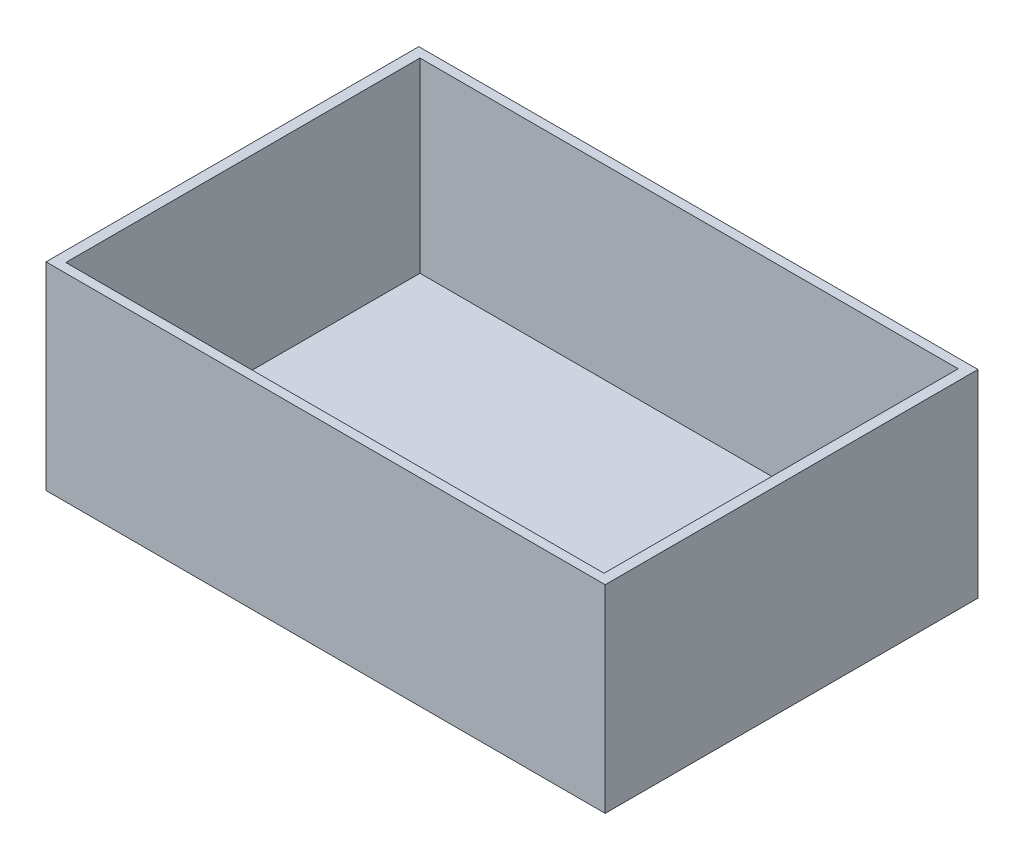
from build123d import *

# Parameters (mm, degrees)
ESQUISSE1_W             = 48
ESQUISSE1_H             = 32
BOSS_EXTRU_1_DEPTH      = 17
ESQUISSE3_W             = 46.2
ESQUISSE3_H             = 30.4
ENL_V_MAT_EXTRU_1_DEPTH = 16


with BuildPart() as part:
    # Esquisse1 → Boss.-Extru.1 (new body)
    with BuildSketch(Plane(origin=(0, 0, 0), x_dir=(1, 0, 0), z_dir=(0, 1, 0))):
        Rectangle(ESQUISSE1_W, ESQUISSE1_H)
    extrude(amount=BOSS_EXTRU_1_DEPTH)

    # Esquisse3 → Enlèv. mat.-Extru.1 (cut)
    with BuildSketch(Plane(origin=(0, 17, 0), x_dir=(1, 0, 0), z_dir=(0, 1, 0))):
        Rectangle(ESQUISSE3_W, ESQUISSE3_H)
    extrude(amount=-ENL_V_MAT_EXTRU_1_DEPTH, mode=Mode.SUBTRACT)


solid = part.part
